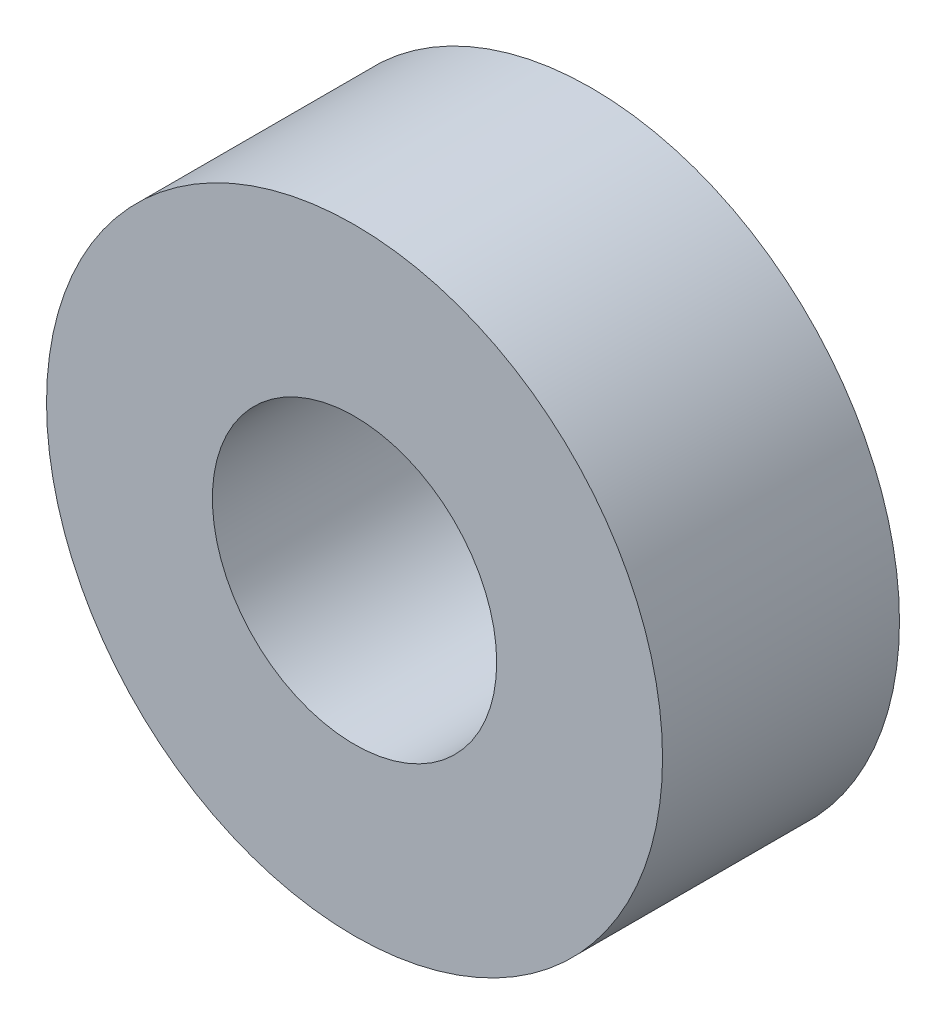
from build123d import *

# Parameters (mm, degrees)
SKETCH1_R           = 6.5
SKETCH1_R_2         = 3
RING_ENVELOPE_DEPTH = 5


with BuildPart() as part:
    # Sketch1 → Ring_Envelope (new body)
    with BuildSketch(Plane.XY):
        Circle(SKETCH1_R)
        Circle(SKETCH1_R_2, mode=Mode.SUBTRACT)
    extrude(amount=RING_ENVELOPE_DEPTH)


solid = part.part
